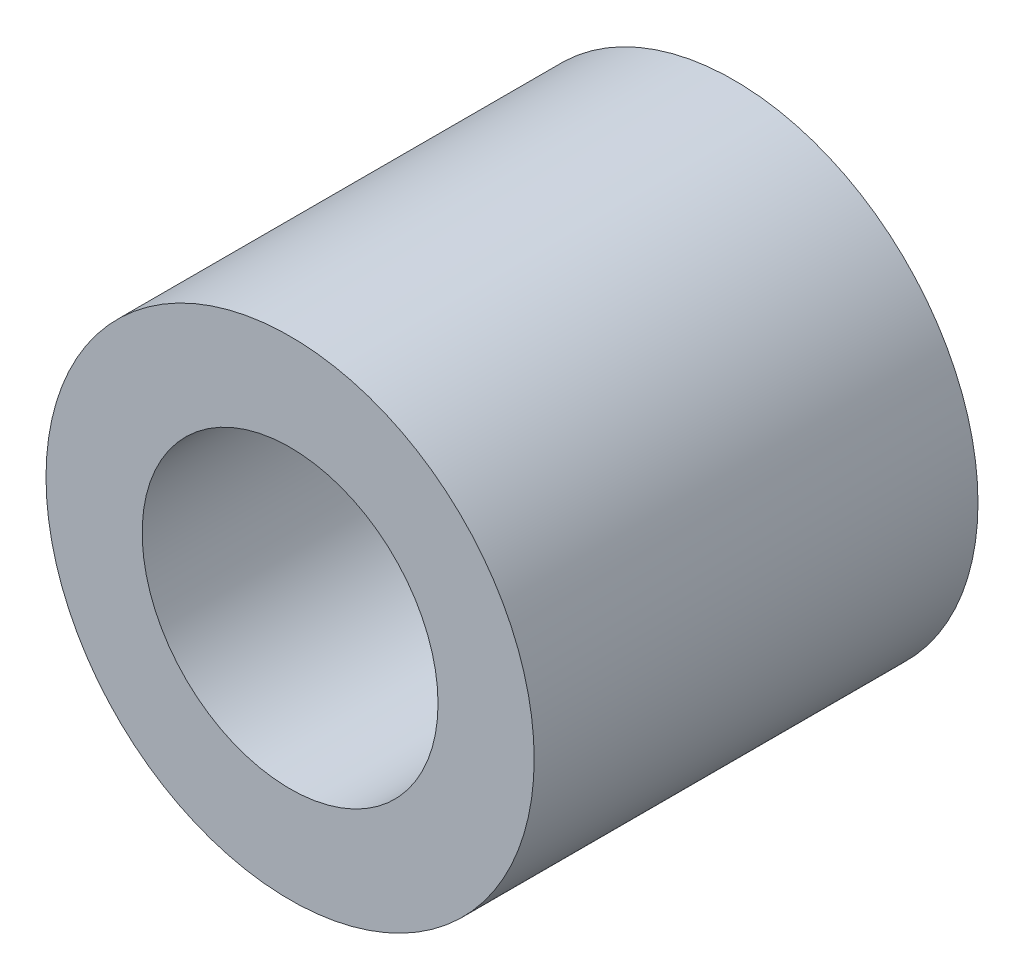
from build123d import *

# Parameters (mm, degrees)
ESQUISSE1_R        = 8.25
ESQUISSE1_R_2      = 5
BOSS_EXTRU_1_DEPTH = 15


with BuildPart() as part:
    # Esquisse1 → Boss.-Extru.1 (new body)
    with BuildSketch(Plane.XY):
        Circle(ESQUISSE1_R)
        Circle(ESQUISSE1_R_2, mode=Mode.SUBTRACT)
    extrude(amount=BOSS_EXTRU_1_DEPTH)


solid = part.part
